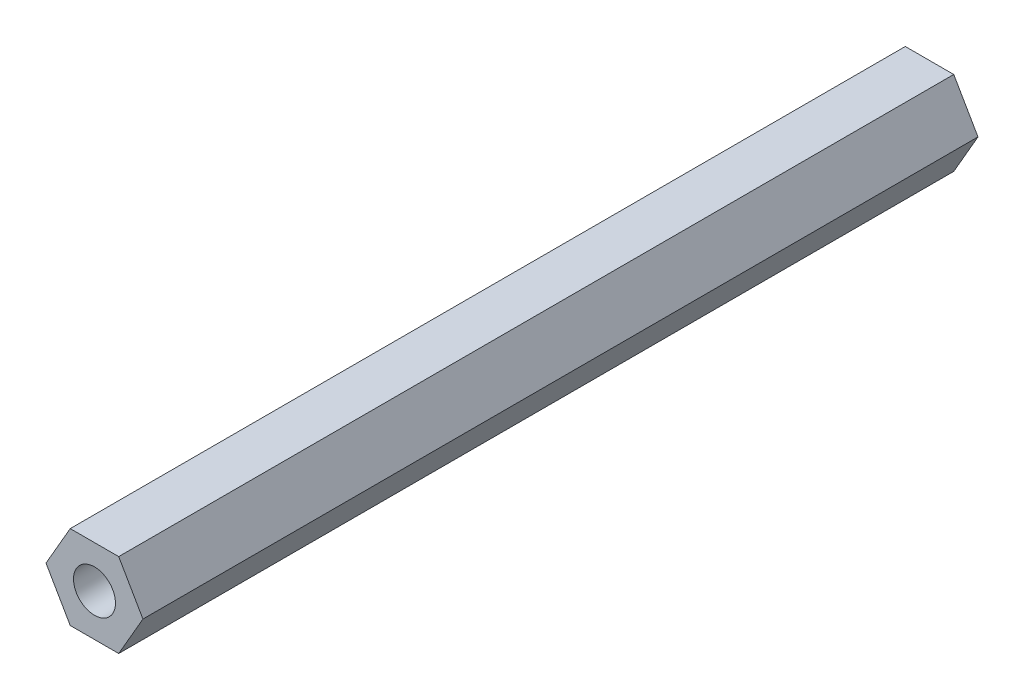
from build123d import *

# Parameters (mm, degrees)
SKETCH1_R           = 3.175
BOSS_EXTRUDE1_DEPTH = 126.3269


with BuildPart() as part:
    # Sketch1 → Boss-Extrude1 (new body)
    with BuildSketch(Plane.XY):
        Polygon((3.666174209, 6.35), (-3.666174209, 6.35), (-7.332348419, 0), (-3.666174209, -6.35), (3.666174209, -6.35), (7.332348419, 0), align=None)
        Circle(SKETCH1_R, mode=Mode.SUBTRACT)
    extrude(amount=BOSS_EXTRUDE1_DEPTH)


solid = part.part
